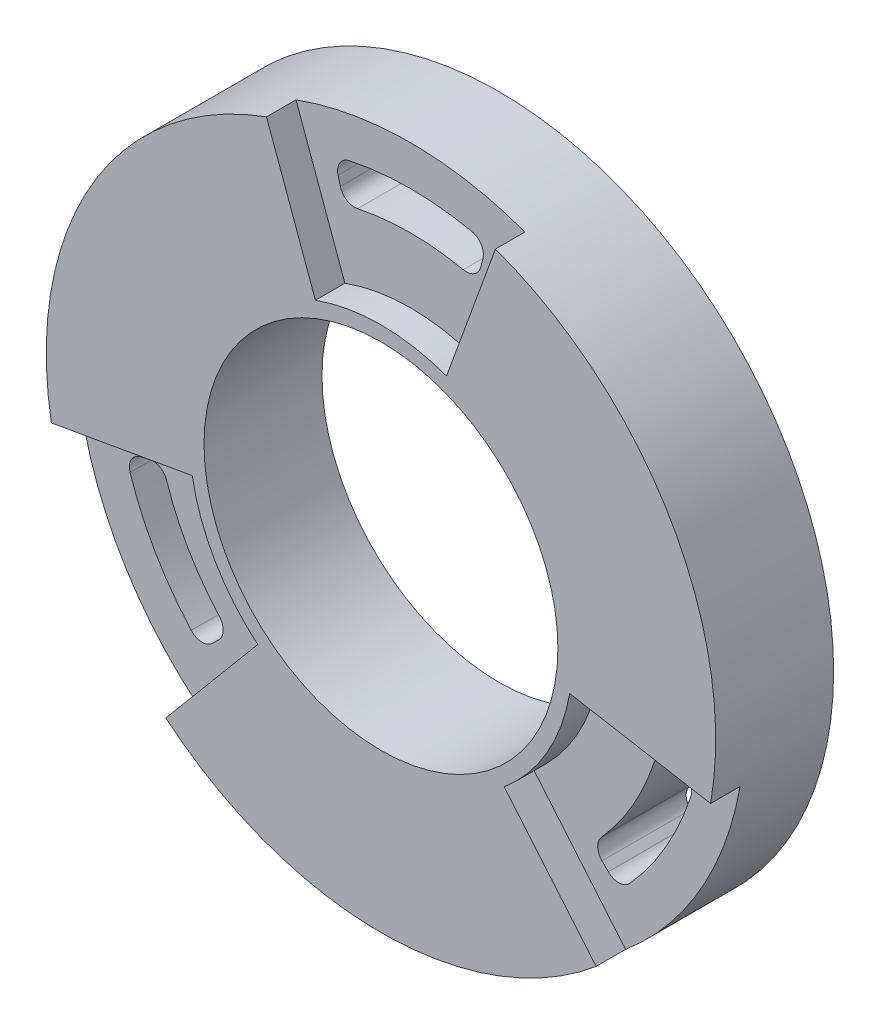
from build123d import *

# Parameters (mm, degrees)
CROQUIS1_R              = 11.35
CROQUIS1_R_2            = 6
SALIENTE_EXTRUIR1_DEPTH = 4
CORTAR_EXTRUIR1_START   = -1
CORTAR_EXTRUIR1_DEPTH   = 1


with BuildPart() as part:
    # Croquis1 → Saliente-Extruir1 (new body)
    with BuildSketch(Plane.XY):
        Circle(CROQUIS1_R)
        Circle(CROQUIS1_R_2, mode=Mode.SUBTRACT)
        with BuildLine():
            Line((2.377616051, 8.873383904), (2.455373053, 9.163576986))
            ThreePointArc((2.455373053, 9.163576986), (2.398691549, 9.55429889), (2.0762212, 9.782091061))
            ThreePointArc((2.0762212, 9.782091061), (0, 10), (-2.0762212, 9.782091061))
            ThreePointArc((-2.0762212, 9.782091061), (-2.398691549, 9.55429889), (-2.455373053, 9.163576986))
            Line((-2.455373053, 9.163576986), (-2.377616051, 8.873383904))
            ThreePointArc((-2.377616051, 8.873383904), (-2.15633175, 8.576736735), (-1.791682859, 8.513511175))
            ThreePointArc((-1.791682859, 8.513511175), (0, 8.7), (1.791682859, 8.513511175))
            ThreePointArc((1.791682859, 8.513511175), (2.15633175, 8.576736735), (2.377616051, 8.873383904))
        make_face(mode=Mode.SUBTRACT)
        with BuildLine():
            Line((8.873383904, -2.377616051), (9.163576986, -2.455373053))
            ThreePointArc((9.163576986, -2.455373053), (9.473611328, -2.699821628), (9.509649961, -3.092985228))
            ThreePointArc((9.509649961, -3.092985228), (8.660254038, -5), (7.433428761, -6.689105834))
            ThreePointArc((7.433428761, -6.689105834), (7.074919779, -6.854477262), (6.708203932, -6.708203932))
            Line((6.708203932, -6.708203932), (6.495767853, -6.495767853))
            ThreePointArc((6.495767853, -6.495767853), (6.34950602, -6.155806442), (6.477075524, -5.808398459))
            ThreePointArc((6.477075524, -5.808398459), (7.534421013, -4.35), (8.268758383, -2.705112716))
            ThreePointArc((8.268758383, -2.705112716), (8.505837769, -2.420930294), (8.873383904, -2.377616051))
        make_face(mode=Mode.SUBTRACT)
        with BuildLine():
            Line((-6.495767853, -6.495767853), (-6.708203932, -6.708203932))
            ThreePointArc((-6.708203932, -6.708203932), (-7.074919779, -6.854477262), (-7.433428761, -6.689105834))
            ThreePointArc((-7.433428761, -6.689105834), (-8.660254038, -5), (-9.509649961, -3.092985228))
            ThreePointArc((-9.509649961, -3.092985228), (-9.473611328, -2.699821628), (-9.163576986, -2.455373053))
            Line((-9.163576986, -2.455373053), (-8.873383904, -2.377616051))
            ThreePointArc((-8.873383904, -2.377616051), (-8.505837769, -2.420930294), (-8.268758383, -2.705112716))
            ThreePointArc((-8.268758383, -2.705112716), (-7.534421013, -4.35), (-6.477075524, -5.808398459))
            ThreePointArc((-6.477075524, -5.808398459), (-6.34950602, -6.155806442), (-6.495767853, -6.495767853))
        make_face(mode=Mode.SUBTRACT)
    extrude(amount=SALIENTE_EXTRUIR1_DEPTH)

    # Croquis2 → Cortar-Extruir1 (cut)
    with BuildSketch(Plane.XY.offset(4).offset(CORTAR_EXTRUIR1_START)):
        with BuildLine():
            Line((2.223130932, 6.108002035), (3.881928627, 10.665511246))
            ThreePointArc((3.881928627, 10.665511246), (0, 11.35), (-3.881928627, 10.665511246))
            Line((-3.881928627, 10.665511246), (-2.223130932, 6.108002035))
            ThreePointArc((-2.223130932, 6.108002035), (0, 6.5), (2.223130932, 6.108002035))
        make_face()
        with BuildLine():
            Line((6.401250395, -1.128713155), (11.177567997, -1.970906817))
            ThreePointArc((11.177567997, -1.970906817), (9.829388333, -5.675), (7.29563937, -8.694604429))
            Line((7.29563937, -8.694604429), (4.178119463, -4.97928888))
            ThreePointArc((4.178119463, -4.97928888), (5.629165125, -3.25), (6.401250395, -1.128713155))
        make_face()
        with BuildLine():
            Line((-4.178119463, -4.97928888), (-7.29563937, -8.694604429))
            ThreePointArc((-7.29563937, -8.694604429), (-9.829388333, -5.675), (-11.177567997, -1.970906817))
            Line((-11.177567997, -1.970906817), (-6.401250395, -1.128713155))
            ThreePointArc((-6.401250395, -1.128713155), (-5.629165125, -3.25), (-4.178119463, -4.97928888))
        make_face()
    extrude(amount=CORTAR_EXTRUIR1_DEPTH, mode=Mode.SUBTRACT)


solid = part.part
